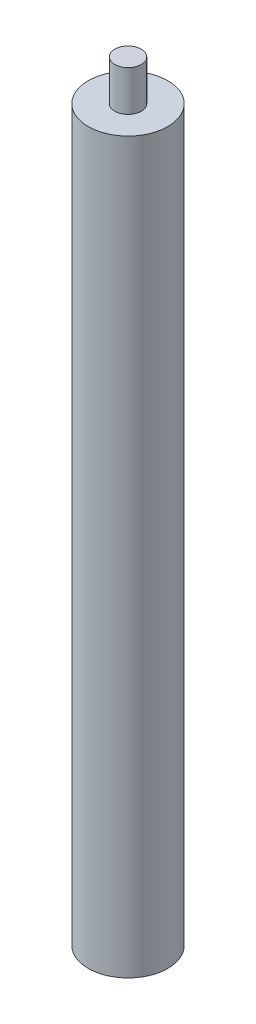
from build123d import *


with BuildPart() as part:
    # Esquisse1 → Révolution1 (revolve)
    with BuildSketch(Plane.XY, mode=Mode.PRIVATE) as r_volution1_sk:
        Polygon((3, 54.055555556), (1, 54.055555556), (1, 57.112678409), (0, 57.112678409), (0, 9.055555556), (0, -0.944444444), (3, -0.944444444), align=None)
    revolve(r_volution1_sk.sketch.rotate(Axis((0, 0, 0), (0, 1, 0)), 90), axis=Axis((0, 0, 0), (0, 1, 0)))


solid = part.part
